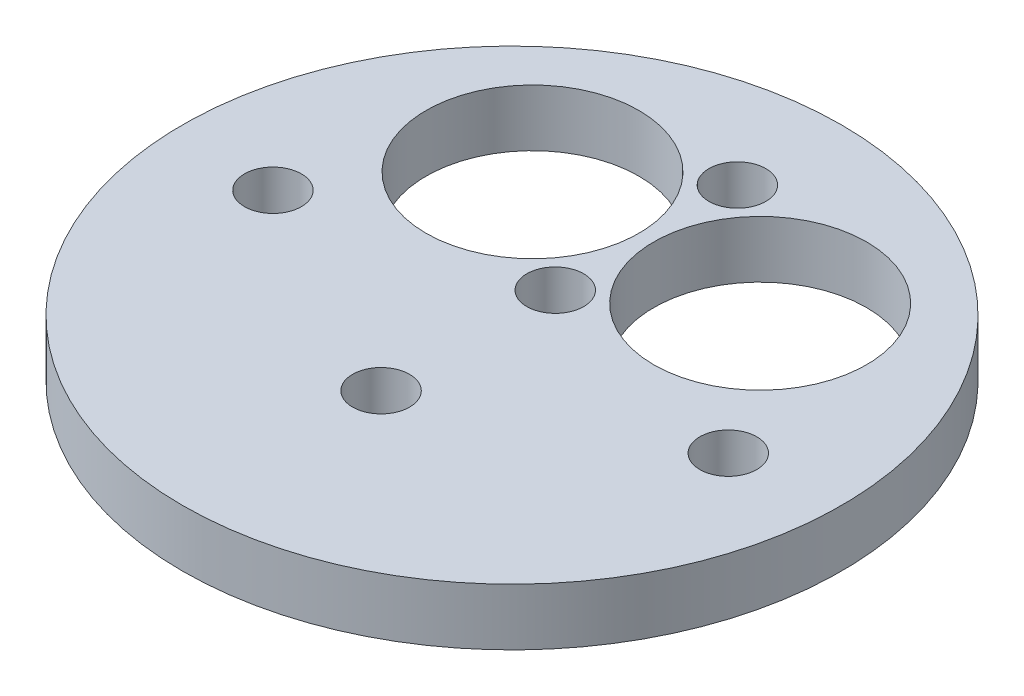
from build123d import *

# Parameters (mm, degrees)
SKETCH1_W               = 36.7665
SKETCH1_H               = 6.35
CUT_EXTRUDE1_DEPTH      = 53.381996378
CUT_EXTRUDE1_DEPTH_BACK = 53.381996378
SKETCH2_R               = 11.8745
SKETCH2_R_2             = 3.175
CUT_EXTRUDE2_DEPTH      = 53.381996378
CUT_EXTRUDE2_DEPTH_BACK = 53.381996378
SKETCH3_R               = 3.175


with BuildPart() as part:
    # Sketch1 → Revolve1 (revolve)
    with BuildSketch(Plane.XY):
        with Locations((18.38325, 3.175)):
            Rectangle(SKETCH1_W, SKETCH1_H)
    revolve(axis=Axis((0, 0, 0), (0, 1, 0)))

    # Sketch2 → Cut-Extrude1 (cut, two sides: drawn at the far end of the back side and taken through both)
    with BuildSketch(Plane(origin=(0, 6.35, 0), x_dir=(1, 0, 0), z_dir=(0, 1, 0)).offset(-CUT_EXTRUDE1_DEPTH_BACK)):
        with Locations((-12.7, 14.986)):
            Circle(SKETCH2_R)
        with Locations((12.7, 14.986)):
            Circle(SKETCH2_R)
        with Locations((0, 25.146)):
            Circle(SKETCH2_R_2)
        with Locations((0, 4.826)):
            Circle(SKETCH2_R_2)
        with Locations((0, -14.605)):
            Circle(SKETCH2_R_2)
    extrude(amount=CUT_EXTRUDE1_DEPTH + CUT_EXTRUDE1_DEPTH_BACK, mode=Mode.SUBTRACT)

    # Sketch3 → Cut-Extrude2 (cut, two sides: drawn at the far end of the back side and taken through both)
    with BuildSketch(Plane(origin=(0, 6.35, 0), x_dir=(1, 0, 0), z_dir=(0, 1, 0)).offset(-CUT_EXTRUDE2_DEPTH_BACK)):
        with Locations((-25.4, -1.27)):
            Circle(SKETCH3_R)
        with Locations((25.4, -1.27)):
            Circle(SKETCH3_R)
    extrude(amount=CUT_EXTRUDE2_DEPTH + CUT_EXTRUDE2_DEPTH_BACK, mode=Mode.SUBTRACT)


solid = part.part
